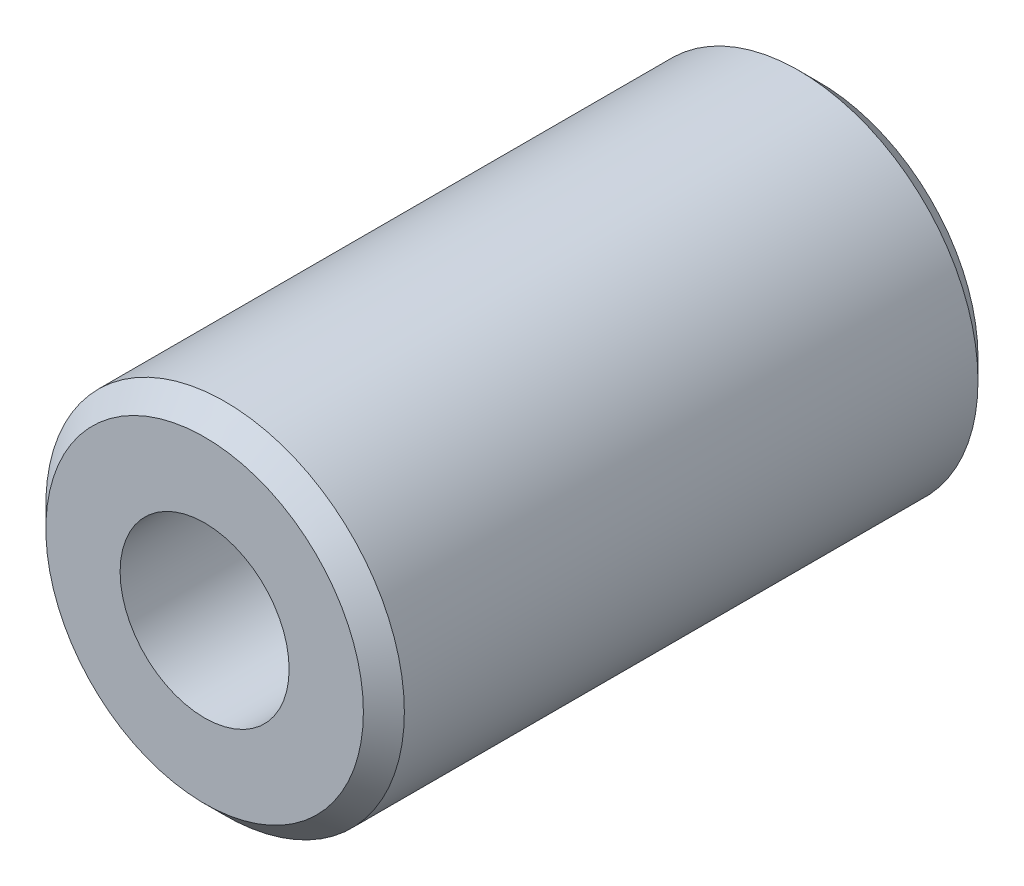
from build123d import *

# Parameters (mm, degrees)
SKETCH_1_R      = 3.5
SKETCH_1_R_2    = 1.65
EXTRUDE_1_DEPTH = 12
CHAMFER_1_SIZE  = 0.4


with BuildPart() as part:
    # 草图1 → 凸台-拉伸1 (new body)
    with BuildSketch(Plane.XY):
        Circle(SKETCH_1_R)
        Circle(SKETCH_1_R_2, mode=Mode.SUBTRACT)
    extrude(amount=EXTRUDE_1_DEPTH)

    # 倒角1
    chamfer_1_edges = [part.edges().sort_by_distance(p)[0] for p in [
        (-3.5, 0, 0),
        (-3.5, 0, 12),
    ]]
    chamfer(chamfer_1_edges, length=CHAMFER_1_SIZE)


solid = part.part
